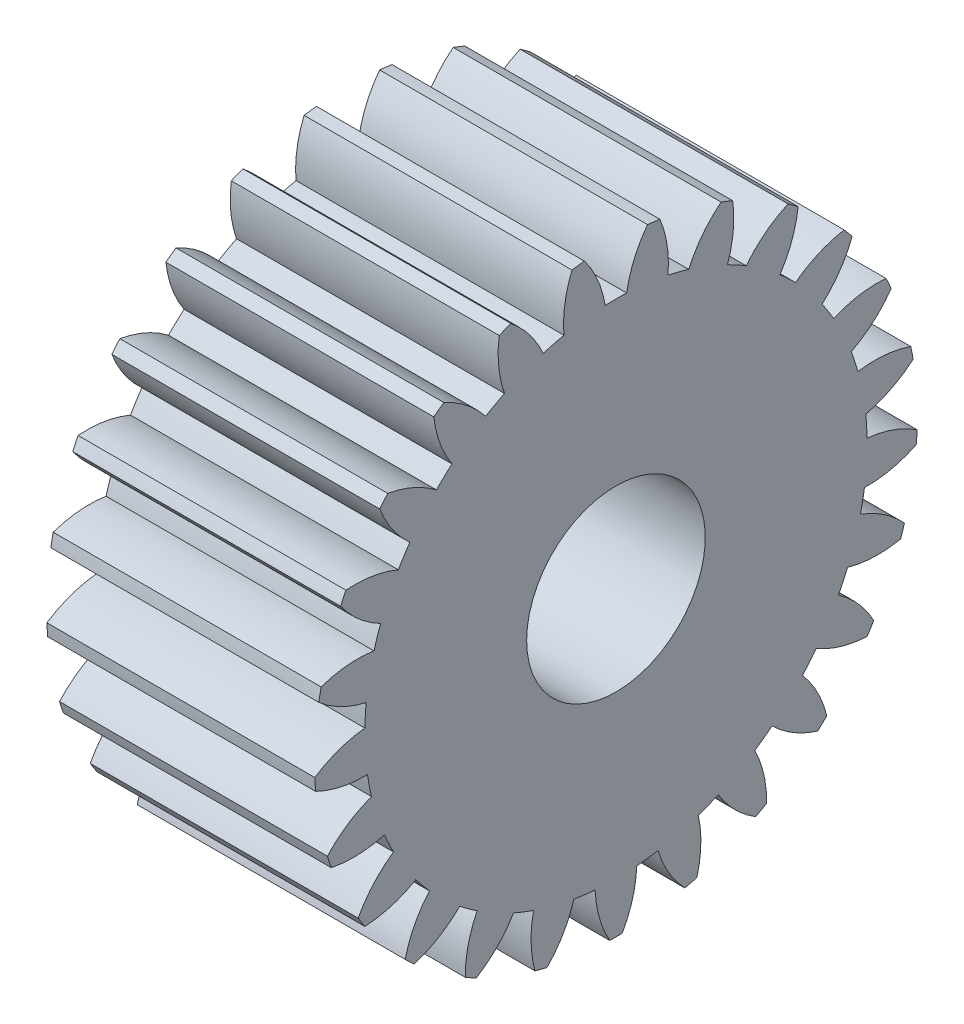
from build123d import *

# Parameters (mm, degrees)
BASPROSKE_W     = 12
BASPROSKE_H     = 13.5
TOOTHCUT_DEPTH  = 23.549944568
TEETHCUTS_COUNT = 25
TEETHCUTS_ANGLE = 345.6
BORSKE_R        = 4
BORE_DEPTH      = 50.0000508


with BuildPart() as part:
    # BasProSke → Base-Revolve (revolve)
    with BuildSketch(Plane(origin=(0, 0, 0), x_dir=(1, 0, 0), z_dir=(0, 1, 0)), mode=Mode.PRIVATE) as base_revolve_sk:
        with Locations((6, 6.75)):
            Rectangle(BASPROSKE_W, BASPROSKE_H)
    revolve(base_revolve_sk.sketch.rotate(Axis((-10, 0, 0), (1, 0, 0)), 180), axis=Axis((-10, 0, 0), (1, 0, 0)))

    # TooCutSke → ToothCut (cut, through all)
    with BuildSketch(Plane(origin=(0, 0, 0), x_dir=(0, 0, -1), z_dir=(1, 0, 0))):
        with BuildLine():
            ThreePointArc((0.480087995, 11.238750665), (0, 11.249), (-0.480087995, 11.238750665))
            ThreePointArc((-0.480087995, 11.238750665), (-0.821124963, 12.40220054), (-1.432168974, 13.449361962))
            ThreePointArc((-1.432168974, 13.449361962), (0, 13.5254), (1.432168974, 13.449361962))
            ThreePointArc((1.432168974, 13.449361962), (0.821124963, 12.40220054), (0.480087995, 11.238750665))
        make_face()
    toothcut = extrude(amount=TOOTHCUT_DEPTH, mode=Mode.SUBTRACT)

    # TeethCuts: ToothCut ×25 about axis
    teethcuts_axis = Axis((-10, 0, 0), (1, 0, 0))
    for i in range(1, TEETHCUTS_COUNT):
        add(toothcut.rotate(teethcuts_axis, i * TEETHCUTS_ANGLE / (TEETHCUTS_COUNT - 1)), mode=Mode.SUBTRACT)

    # BorSke → Bore (cut, symmetric)
    with BuildSketch(Plane(origin=(0, 0, 0), x_dir=(0, 0, -1), z_dir=(1, 0, 0))):
        with Locations(Location((0, 0, 0), (0, 0, 180))):
            Circle(BORSKE_R)
    extrude(amount=BORE_DEPTH, both=True, mode=Mode.SUBTRACT)


solid = part.part
